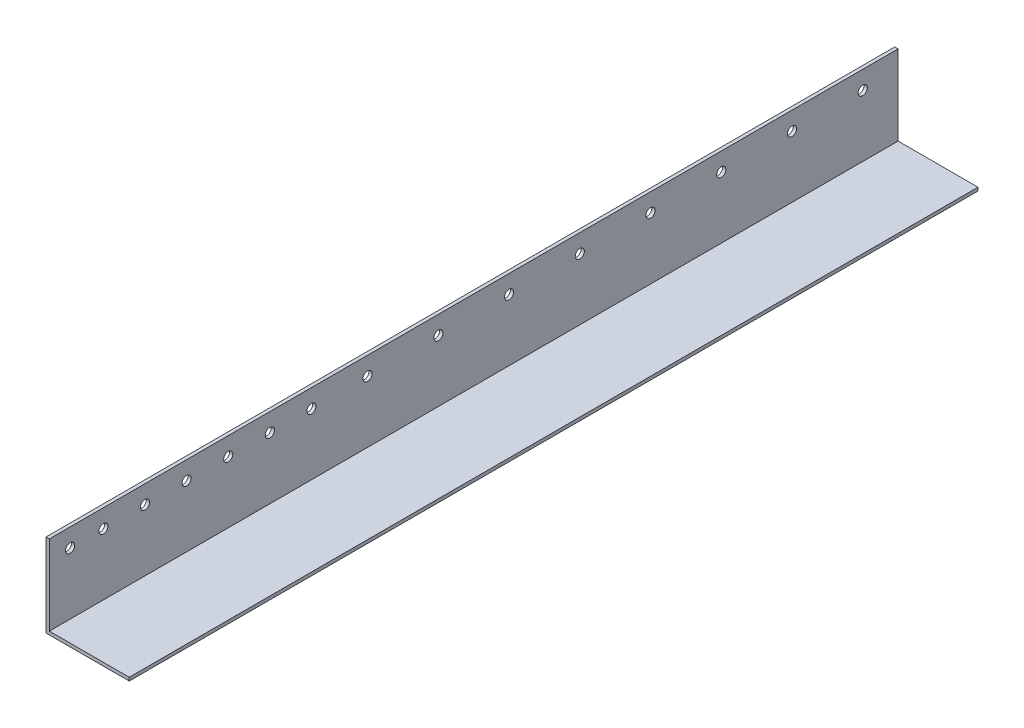
from build123d import *

# Parameters (mm, degrees)
BOSS_EXTRUDE1_DEPTH = 510
SKETCH2_R           = 2.75
CUT_EXTRUDE1_DEPTH  = 5


with BuildPart() as part:
    # Sketch1 → Boss-Extrude1 (new body)
    with BuildSketch(Plane.XY):
        Polygon((0, 0), (50, 0), (50, 2), (2, 2), (2, 50), (0, 50), align=None)
    extrude(amount=BOSS_EXTRUDE1_DEPTH)

    # Sketch2 → Cut-Extrude1 (cut, symmetric)
    with BuildSketch(Plane(origin=(0, 0, 0), x_dir=(0, 0, -1), z_dir=(1, 0, 0))):
        with Locations((-21.25, 39)):
            Circle(SKETCH2_R)
        with Locations((-63.75, 39)):
            Circle(SKETCH2_R)
        with Locations((-106.25, 39)):
            Circle(SKETCH2_R)
        with Locations((-148.75, 39)):
            Circle(SKETCH2_R)
        with Locations((-191.25, 39)):
            Circle(SKETCH2_R)
        with Locations((-233.75, 39)):
            Circle(SKETCH2_R)
        with Locations((-276.25, 39)):
            Circle(SKETCH2_R)
        with Locations((-318.75, 39)):
            Circle(SKETCH2_R)
        with Locations((-352.5, 39)):
            Circle(SKETCH2_R)
        with Locations((-377.5, 39)):
            Circle(SKETCH2_R)
        with Locations((-402.5, 39)):
            Circle(SKETCH2_R)
        with Locations((-427.5, 39)):
            Circle(SKETCH2_R)
        with Locations((-452.5, 39)):
            Circle(SKETCH2_R)
        with Locations((-477.5, 39)):
            Circle(SKETCH2_R)
        with Locations((-497.5, 39)):
            Circle(SKETCH2_R)
    extrude(amount=CUT_EXTRUDE1_DEPTH, both=True, mode=Mode.SUBTRACT)


solid = part.part
